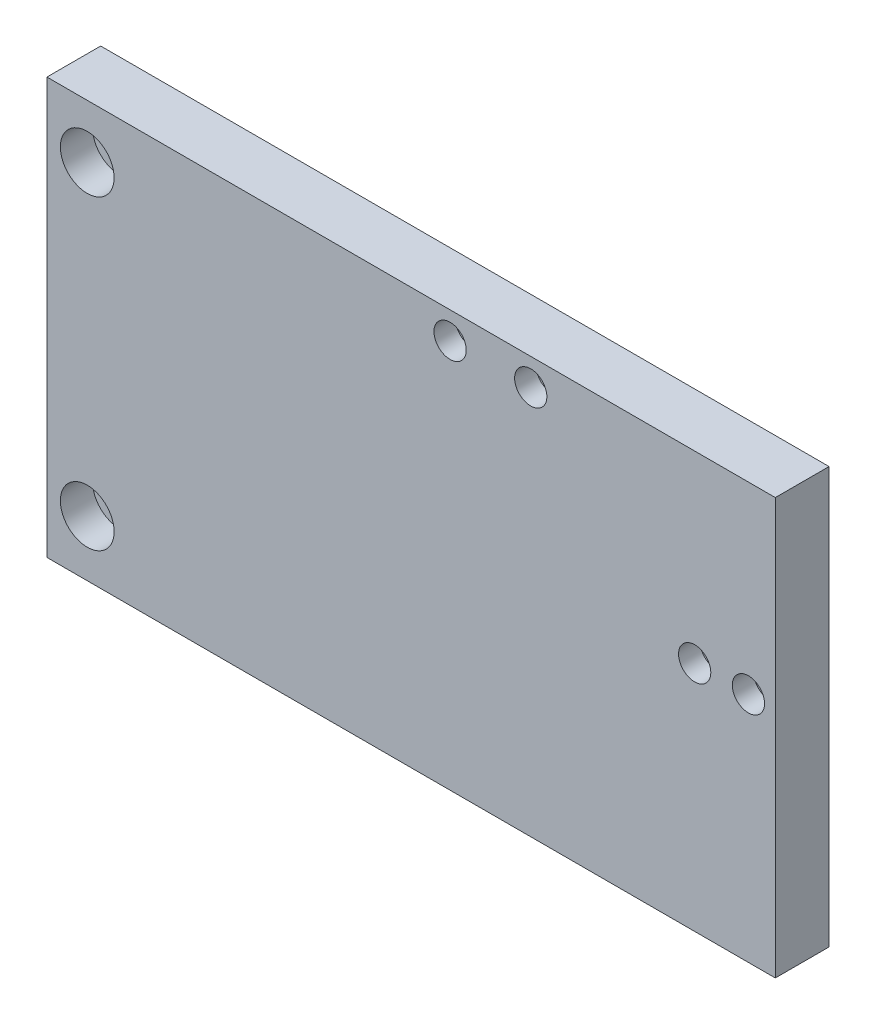
from build123d import *

# Parameters (mm, degrees)
SKETCH_1_W                   = 135.5
SKETCH_1_H                   = 77.4
EXTRUDE_1_DEPTH              = 10
HOLE_WIZARD_M3_1_D           = 3.4
HOLE_WIZARD_M3_1_CBORE_D     = 6
HOLE_WIZARD_M3_1_CBORE_DEPTH = 4
HOLE_WIZARD_M3_2_D           = 3.4
HOLE_WIZARD_M3_2_CBORE_D     = 6
HOLE_WIZARD_M3_2_CBORE_DEPTH = 4
HOLE_WIZARD_M5_1_D           = 5.5
HOLE_WIZARD_M5_1_CBORE_D     = 10
HOLE_WIZARD_M5_1_CBORE_DEPTH = 6


with BuildPart() as part:
    # ｽｹｯﾁ1 → ﾎﾞｽ - 押し出し1 (new body)
    with BuildSketch(Plane.XY):
        with Locations((67.75, 38.7)):
            Rectangle(SKETCH_1_W, SKETCH_1_H)
    extrude(amount=EXTRUDE_1_DEPTH)

    # M3 穴付きねじ用座ぐり穴1 (through all)
    with Locations(Plane.XY.offset(10)):
        with Locations((130.5, 43.2), (120.5, 43.2)):
            CounterBoreHole(HOLE_WIZARD_M3_1_D / 2, HOLE_WIZARD_M3_1_CBORE_D / 2, HOLE_WIZARD_M3_1_CBORE_DEPTH)

    # M3 穴付きねじ用座ぐり穴2 (through all)
    with Locations(Plane.XY.offset(10)):
        with Locations((130.5, 43.2), (75, 72.4), (90, 72.4), (120.5, 43.2)):
            CounterBoreHole(HOLE_WIZARD_M3_2_D / 2, HOLE_WIZARD_M3_2_CBORE_D / 2, HOLE_WIZARD_M3_2_CBORE_DEPTH)

    # M5 穴付きねじ用座ぐり穴1 (through all)
    with Locations(Plane.XY.offset(10)):
        with Locations((7.5, 67.4), (7.5, 10.4)):
            CounterBoreHole(HOLE_WIZARD_M5_1_D / 2, HOLE_WIZARD_M5_1_CBORE_D / 2, HOLE_WIZARD_M5_1_CBORE_DEPTH)


solid = part.part
